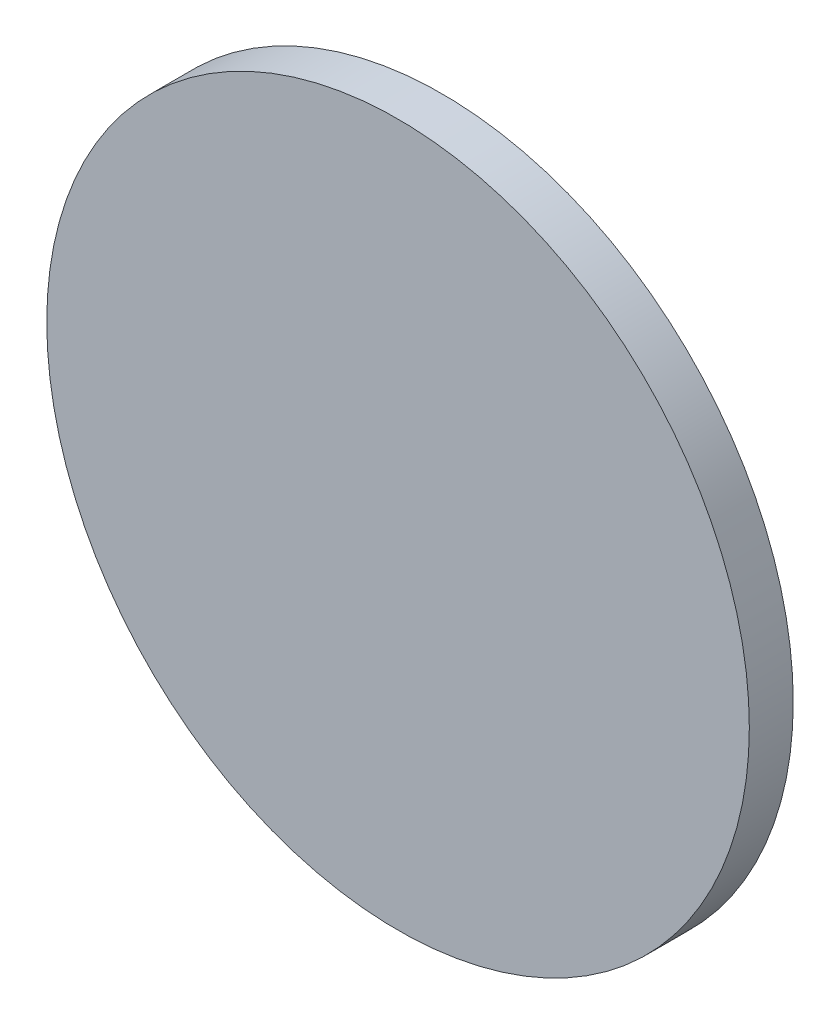
from build123d import *

# Parameters (mm, degrees)
ESQUISSE1_R        = 12
BOSS_EXTRU_1_DEPTH = 1.5


with BuildPart() as part:
    # Esquisse1 → Boss.-Extru.1 (new body)
    with BuildSketch(Plane.XY):
        Circle(ESQUISSE1_R)
    extrude(amount=BOSS_EXTRU_1_DEPTH)


solid = part.part
